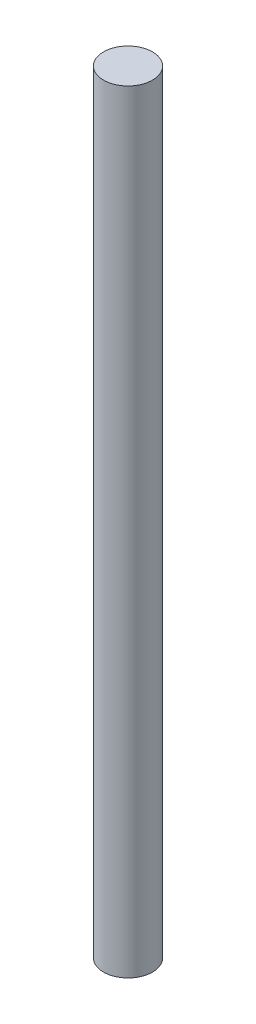
from build123d import *

# Parameters (mm, degrees)
SKETCH1_R           = 6.5
BOSS_EXTRUDE1_DEPTH = 205


with BuildPart() as part:
    # Sketch1 → Boss-Extrude1 (new body)
    with BuildSketch(Plane(origin=(0, 0, 0), x_dir=(1, 0, 0), z_dir=(0, 1, 0))):
        with Locations(Location((0, 0, 0), (0, 0, 90))):
            Circle(SKETCH1_R)
    extrude(amount=BOSS_EXTRUDE1_DEPTH)


solid = part.part
